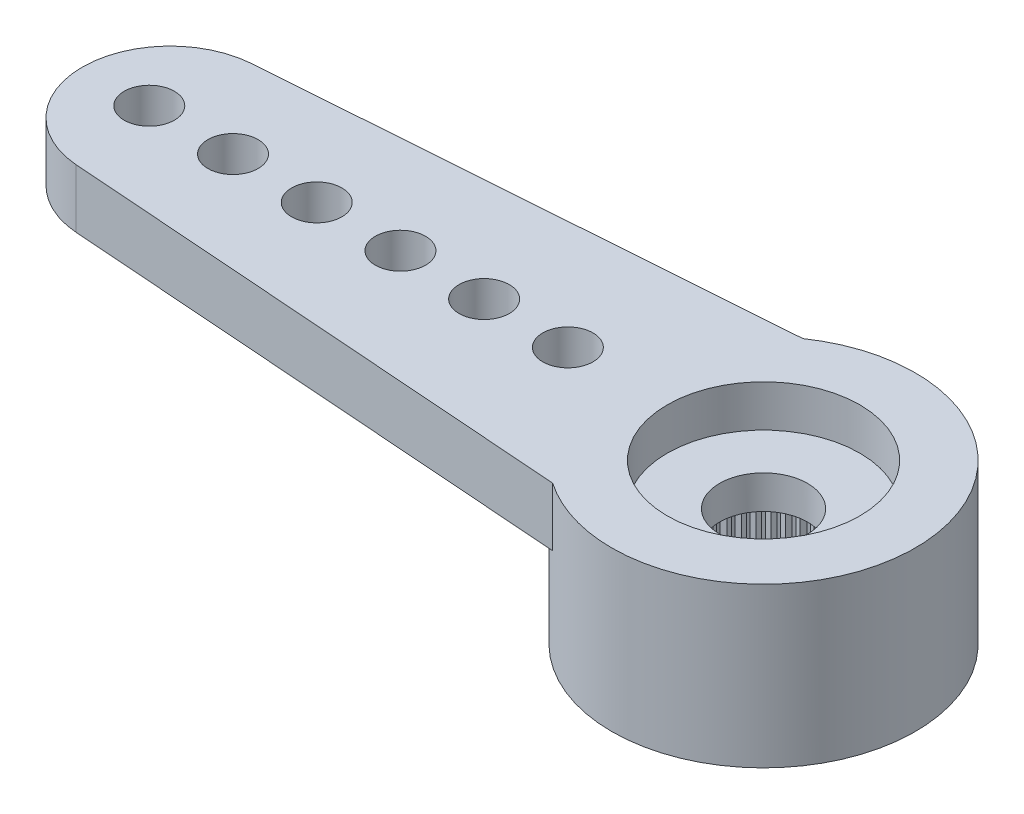
from build123d import *

# Parameters (mm, degrees)
RESSALTO_EXTRUS_O1_DEPTH = 1.4
ESBO_O2_R                = 3.625
RESSALTO_EXTRUS_O2_DEPTH = 2.4
FURO4_D                  = 1.2
PADR_O_LINEAR1_COUNT     = 6
PADR_O_LINEAR1_PITCH     = 2
FURO1_D                  = 4.95
FURO1_DEPTH              = 2
FURO2_D                  = 4.6
FURO2_DEPTH              = 1
FURO3_D                  = 2.1
RESSALTO_EXTRUS_O3_START = -2
RESSALTO_EXTRUS_O3_DEPTH = 2
PADR_OCIRCULAR1_COUNT    = 60


with BuildPart() as part:
    # Esboço1 → Ressalto-extrusão1 (new body)
    with BuildSketch(Plane(origin=(0, 0, 0), x_dir=(1, 0, 0), z_dir=(0, 1, 0))):
        with BuildLine():
            Line((-14.327766208, 2.094436078), (-2.049518236, 2.99))
            ThreePointArc((-2.049518236, 2.99), (3.625, 0), (-2.049518236, -2.99))
            Line((-2.049518236, -2.99), (-14.327766208, -2.094436078))
            ThreePointArc((-14.327766208, -2.094436078), (-16.275, 0), (-14.327766208, 2.094436078))
        make_face()
    extrude(amount=-RESSALTO_EXTRUS_O1_DEPTH)

    # Esboço2 → Ressalto-extrusão2 (add)
    with BuildSketch(Plane.XZ.offset(1.4)):
        with Locations(Location((0, 0, 0), (0, 0, 90))):
            Circle(ESBO_O2_R)
    extrude(amount=RESSALTO_EXTRUS_O2_DEPTH)

    # Furo4 (through all)
    with Locations(Plane(origin=(0, 0, 0), x_dir=(1, 0, 0), z_dir=(0, 1, 0))):
        with Locations((-14.675, 0)):
            furo4 = Hole(FURO4_D / 2)

    # Padrão linear1: Furo4 ×6
    with Locations(*[(i * PADR_O_LINEAR1_PITCH, 0, 0) for i in range(1, PADR_O_LINEAR1_COUNT)]):
        add(furo4, mode=Mode.SUBTRACT)

    # Furo1
    with Locations(Plane(origin=(0, -3.8, 0), x_dir=(-1, 0, 0), z_dir=(0, -1, 0))):
        with Locations((0, 0)):
            Hole(FURO1_D / 2, depth=FURO1_DEPTH)

    # Furo2
    with Locations(Plane(origin=(0, 0, 0), x_dir=(1, 0, 0), z_dir=(0, 1, 0))):
        with Locations((0, 0)):
            Hole(FURO2_D / 2, depth=FURO2_DEPTH)

    # Furo3 (through all)
    with Locations(Plane(origin=(0, 0, 0), x_dir=(1, 0, 0), z_dir=(0, 1, 0))):
        with Locations((0, 0)):
            Hole(FURO3_D / 2)

    # Esboço11 → Ressalto-extrusão3 (add)
    with BuildSketch(Plane.XZ.offset(3.8).offset(RESSALTO_EXTRUS_O3_START)):
        with BuildLine():
            Line((-0.098056786, 2.473056786), (0, 2.375))
            Line((0, 2.375), (0.098056786, 2.473056786))
            ThreePointArc((0.098056786, 2.473056786), (0, 2.475), (-0.098056786, 2.473056786))
        make_face()
    ressalto_extrus_o3 = extrude(amount=RESSALTO_EXTRUS_O3_DEPTH)

    # PadrãoCircular1: Ressalto-extrusão3 ×60 about axis
    padr_ocircular1_axis = Axis((0, 0, 0), (0, 1, 0))
    for i in range(1, PADR_OCIRCULAR1_COUNT):
        add(ressalto_extrus_o3.rotate(padr_ocircular1_axis, i * 360 / PADR_OCIRCULAR1_COUNT))


solid = part.part
